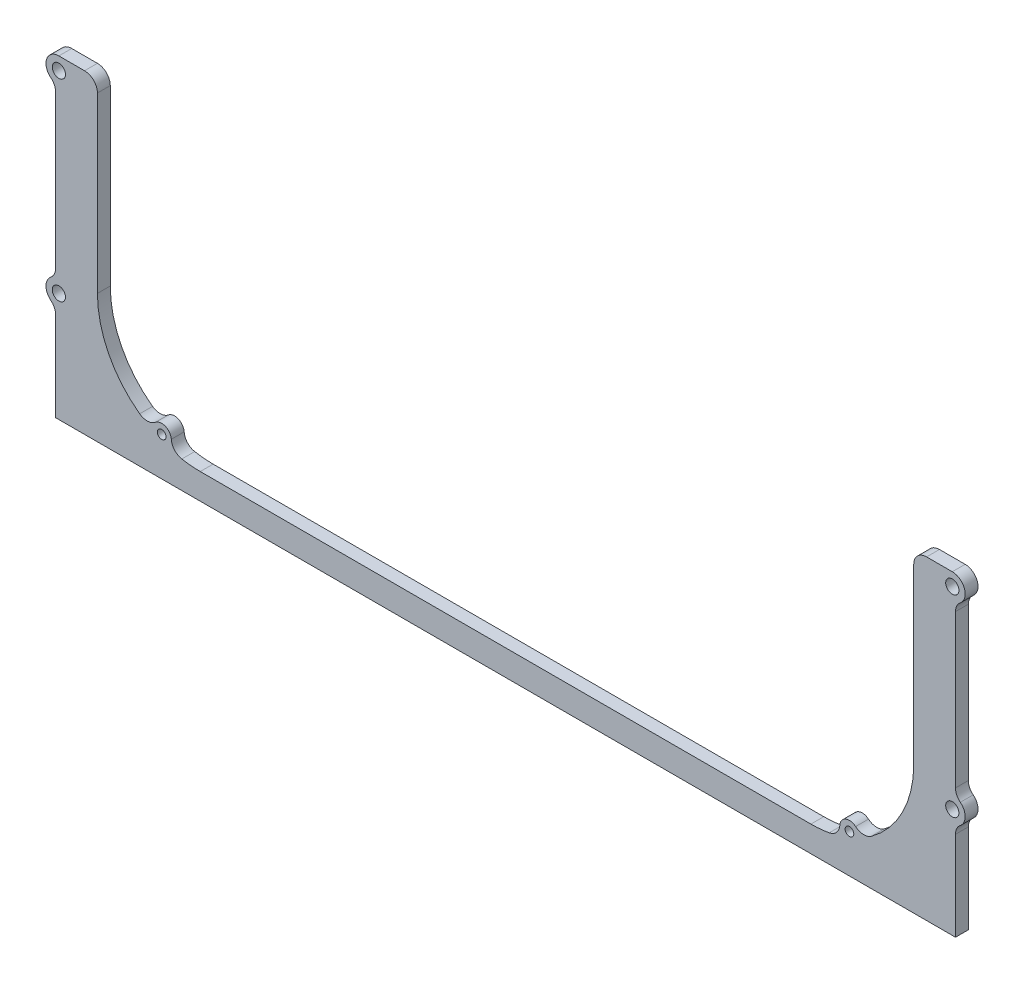
from build123d import *

# Parameters (mm, degrees)
SKETCH1_R            = 6.35
SKETCH1_R_2          = 3.2639
SKETCH1_R_3          = 2.1463
BOSS_EXTRUDE1_DEPTH  = 6.35
FILLET1_R            = 6.35
FILLET2_R            = 6.35
FILLET1_OF_MIRROR1_R = 6.35
FILLET2_OF_MIRROR1_R = 6.35


with BuildPart() as part:
    # Sketch1 → Boss-Extrude1 (new body)
    # profile 1 of 5: a face of its own
    with BuildSketch(Plane(origin=(0, 0, -190.5), x_dir=(-1, 0, 0), z_dir=(0, 0, -1))):
        with BuildLine():
            Line((-222.25, 270.076638938), (-222.25, 187.123361062))
            ThreePointArc((-222.25, 187.123361062), (-216.773935033, 185.995115786), (-214.3125, 180.975))
            ThreePointArc((-214.3125, 180.975), (-216.773935033, 175.954884214), (-222.25, 174.826638938))
            Line((-222.25, 174.826638938), (-222.25, 127))
            Line((-222.25, 127), (0, 127))
            Line((0, 127), (0, 139.7))
            Line((0, 139.7), (-150.8125, 139.7))
            ThreePointArc((-150.8125, 139.7), (-158.964771181, 140.358395772), (-166.90572658, 142.316516748))
            ThreePointArc((-166.90572658, 142.316516748), (-171.738540659, 141.672571795), (-174.60521092, 145.616295752))
            ThreePointArc((-174.60521092, 145.616295752), (-194.340133262, 164.308681923), (-201.6125, 190.5))
            Line((-201.6125, 190.5), (-201.6125, 282.575))
            Line((-201.6125, 282.575), (-220.6625, 282.575))
            ThreePointArc((-220.6625, 282.575), (-216.172371939, 280.715128061), (-214.3125, 276.225))
            ThreePointArc((-214.3125, 276.225), (-216.773935033, 271.204884214), (-222.25, 270.076638938))
        make_face()
    # profile 2 of 5: a face of its own
    with BuildSketch(Plane(origin=(0, 0, -190.5), x_dir=(-1, 0, 0), z_dir=(0, 0, -1))):
        with Locations((-220.6625, 276.225)):
            Circle(SKETCH1_R)
        with Locations((-220.6625, 276.225)):
            Circle(SKETCH1_R_2, mode=Mode.SUBTRACT)
    # profile 3 of 5: a face of its own
    with BuildSketch(Plane(origin=(0, 0, -190.5), x_dir=(-1, 0, 0), z_dir=(0, 0, -1))):
        with Locations((-220.6625, 180.975)):
            Circle(SKETCH1_R)
        with Locations((-220.6625, 180.975)):
            Circle(SKETCH1_R_2, mode=Mode.SUBTRACT)
    # profile 4 of 5: a face of its own
    with BuildSketch(Plane(origin=(0, 0, -190.5), x_dir=(-1, 0, 0), z_dir=(0, 0, -1))):
        with BuildLine():
            ThreePointArc((-165.1, 146.05), (-170.079577741, 150.807550158), (-174.60521092, 145.616295752))
            ThreePointArc((-174.60521092, 145.616295752), (-170.823600368, 143.807432475), (-166.90572658, 142.316516748))
            ThreePointArc((-166.90572658, 142.316516748), (-165.575132529, 143.976383252), (-165.1, 146.05))
        make_face()
        with Locations((-169.8625, 146.05)):
            Circle(SKETCH1_R_3, mode=Mode.SUBTRACT)
    # profile 5 of 5: a face of its own
    with BuildSketch(Plane(origin=(0, 0, -190.5), x_dir=(-1, 0, 0), z_dir=(0, 0, -1))):
        with BuildLine():
            ThreePointArc((-166.90572658, 142.316516748), (-170.823600368, 143.807432475), (-174.60521092, 145.616295752))
            ThreePointArc((-174.60521092, 145.616295752), (-171.738540659, 141.672571795), (-166.90572658, 142.316516748))
        make_face()
    boss_extrude1 = extrude(amount=BOSS_EXTRUDE1_DEPTH)

    # Fillet1
    fillet1_edges = [part.edges().sort_by_distance(p)[0] for p in [
        (174.60521092, 145.616295752, -193.675),
        (166.90572658, 142.316516748, -193.675),
    ]]
    fillet(fillet1_edges, radius=FILLET1_R)

    # Fillet2
    fillet2_edges = [part.edges().sort_by_distance(p)[0] for p in [
        (222.25, 174.826638938, -193.675),
        (222.25, 187.123361062, -193.675),
        (222.25, 270.076638938, -193.675),
        (201.6125, 282.575, -193.675),
    ]]
    fillet(fillet2_edges, radius=FILLET2_R)

    # Mirror1: Boss-Extrude1 across plane
    add(boss_extrude1.mirror(Plane(origin=(0, 0, 0), x_dir=(0, 0, 1), z_dir=(1, 0, 0))))

    # Fillet1 of Mirror1
    fillet1_of_mirror1_edges = [part.edges().sort_by_distance(p)[0] for p in [
        (-174.60521092, 145.616295752, -193.675),
        (-166.90572658, 142.316516748, -193.675),
    ]]
    fillet(fillet1_of_mirror1_edges, radius=FILLET1_OF_MIRROR1_R)

    # Fillet2 of Mirror1
    fillet2_of_mirror1_edges = [part.edges().sort_by_distance(p)[0] for p in [
        (-222.25, 174.826638938, -193.675),
        (-222.25, 187.123361062, -193.675),
        (-222.25, 270.076638938, -193.675),
        (-201.6125, 282.575, -193.675),
    ]]
    fillet(fillet2_of_mirror1_edges, radius=FILLET2_OF_MIRROR1_R)


solid = part.part
